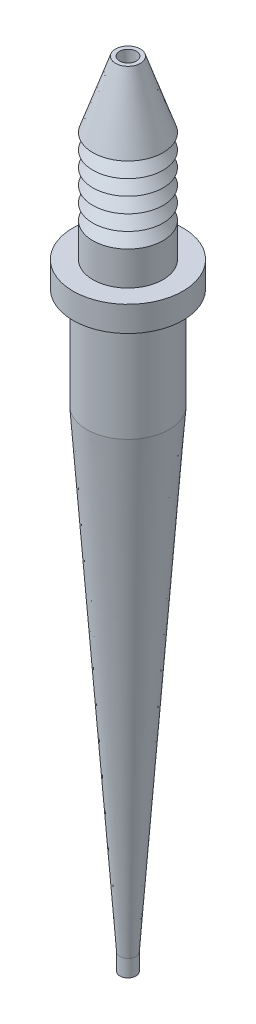
from build123d import *

# Parameters (mm, degrees)
CHAMFER1_SIZE = 0.2


with BuildPart() as part:
    # Sketch1 → Revolve1 (revolve)
    with BuildSketch(Plane.XY, mode=Mode.PRIVATE) as revolve1_sk:
        Polygon((0.95, -9.336734694), (0.95, -7.336734694), (4.875, 48.663265306), (4.875, 60.663265306), (6.5, 60.663265306), (6.5, 63.663265306), (4.15, 63.663265306), (4.15, 67.663265306), (2.648417251, 69.46850915), (4.15, 69.46850915), (2.648417251, 71.273752994), (4.15, 71.273752994), (2.648417251, 73.078996837), (4.15, 73.078996837), (2.648417251, 74.884240681), (4.15, 74.884240681), (2.648417251, 76.689484525), (4.15, 76.689484525), (1.474206394, 84.510756718), (1, 84.510756718), (1, 68.96850915), (2, 63.663265306), (2, 60.663265306), (0.275, -7.002676295), (0.275, -8.336734694), (0.575, -8.336734694), (0.575, -9.336734694), align=None)
    revolve(revolve1_sk.sketch.rotate(Axis((0, 103.014460247, 0), (0, -1, 0)), 90), axis=Axis((0, 103.014460247, 0), (0, -1, 0)))

    # Chamfer1
    chamfer1_edges = [part.edges().sort_by_distance(p)[0] for p in [
        (0, -9.336734694, -0.575),
    ]]
    chamfer(chamfer1_edges, length=CHAMFER1_SIZE)


solid = part.part
